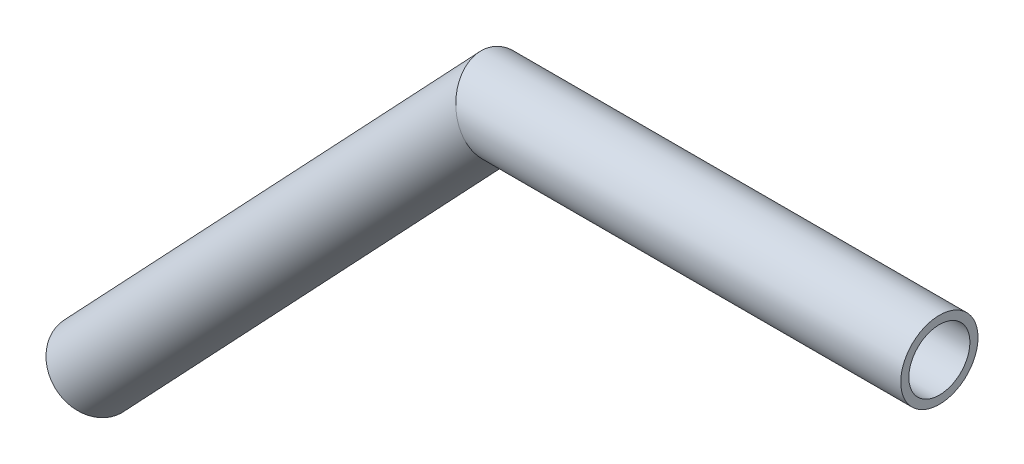
from build123d import *

# Parameters (mm, degrees)
SKETCH1_R   = 13.335
SKETCH1_R_2 = 10.541


with BuildPart() as part:
    # Sweep1: sweep along a path in Sketch2
    with BuildLine(Plane.XY) as sweep1_path:
        Line((0, 0), (-152.4, 0))
        Line((-152.4, 0), (-291.887288868, -147.761755012))
    # Sketch1 → Sweep1 (sweep)
    with BuildSketch(Plane(origin=(0, 0, 0), x_dir=(0, 0, -1), z_dir=(1, 0, 0))):
        Circle(SKETCH1_R)
        Circle(SKETCH1_R_2, mode=Mode.SUBTRACT)
    sweep(path=sweep1_path.line, transition=Transition.RIGHT)


solid = part.part
